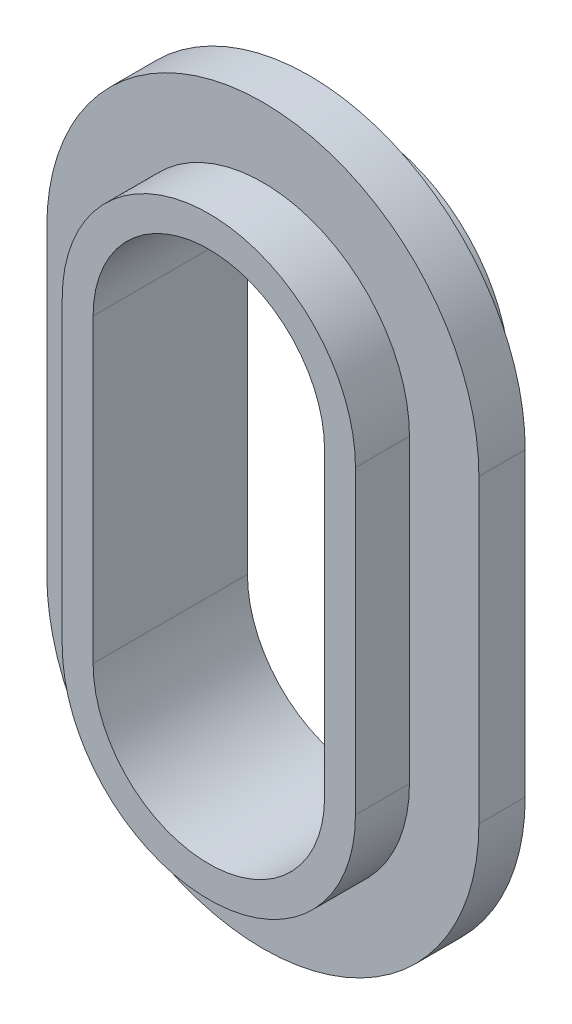
from build123d import *

# Parameters (mm, degrees)
BOSS_EXTRUDE1_DEPTH      = 0.6
BOSS_EXTRUDE1_DEPTH_BACK = 0.6
BOSS_EXTRUDE2_DEPTH      = 2
BOSS_EXTRUDE2_DEPTH_BACK = 2
CUT_EXTRUDE1_DEPTH       = 15.660150067
CUT_EXTRUDE1_DEPTH_BACK  = 15.660150067


with BuildPart() as part:
    # Sketch1 → Boss-Extrude1 (new, two sides: drawn at the far end of the back side and taken through both)
    with BuildSketch(Plane.XY.offset(-BOSS_EXTRUDE1_DEPTH_BACK)):
        with BuildLine():
            Line((5.6, -7.8), (5.6, 0))
            ThreePointArc((5.6, 0), (0, 5.6), (-5.6, 0))
            Line((-5.6, 0), (-5.6, -7.8))
            ThreePointArc((-5.6, -7.8), (0, -13.4), (5.6, -7.8))
        make_face()
        with BuildLine():
            ThreePointArc((-3, 0), (0, 3), (3, 0))
            Line((3, 0), (3, -7.8))
            ThreePointArc((3, -7.8), (0, -10.8), (-3, -7.8))
            Line((-3, -7.8), (-3, 0))
        make_face(mode=Mode.SUBTRACT)
    extrude(amount=BOSS_EXTRUDE1_DEPTH + BOSS_EXTRUDE1_DEPTH_BACK)

    # Sketch1<3> → Boss-Extrude2 (add, two sides: drawn at the far end of the back side and taken through both)
    with BuildSketch(Plane.XY.offset(-BOSS_EXTRUDE2_DEPTH_BACK)):
        with BuildLine():
            Line((3.8, 0), (3.8, -7.8))
            ThreePointArc((3.8, -7.8), (0, -11.6), (-3.8, -7.8))
            Line((-3.8, -7.8), (-3.8, 0))
            ThreePointArc((-3.8, 0), (0, 3.8), (3.8, 0))
        make_face()
    extrude(amount=BOSS_EXTRUDE2_DEPTH + BOSS_EXTRUDE2_DEPTH_BACK)

    # Sketch1<4> → Cut-Extrude1 (cut, two sides: drawn at the far end of the back side and taken through both)
    with BuildSketch(Plane.XY.offset(-CUT_EXTRUDE1_DEPTH_BACK)):
        with BuildLine():
            Line((3, 0), (3, -7.8))
            ThreePointArc((3, -7.8), (0, -10.8), (-3, -7.8))
            Line((-3, -7.8), (-3, 0))
            ThreePointArc((-3, 0), (0, 3), (3, 0))
        make_face()
    extrude(amount=CUT_EXTRUDE1_DEPTH + CUT_EXTRUDE1_DEPTH_BACK, mode=Mode.SUBTRACT)


solid = part.part
